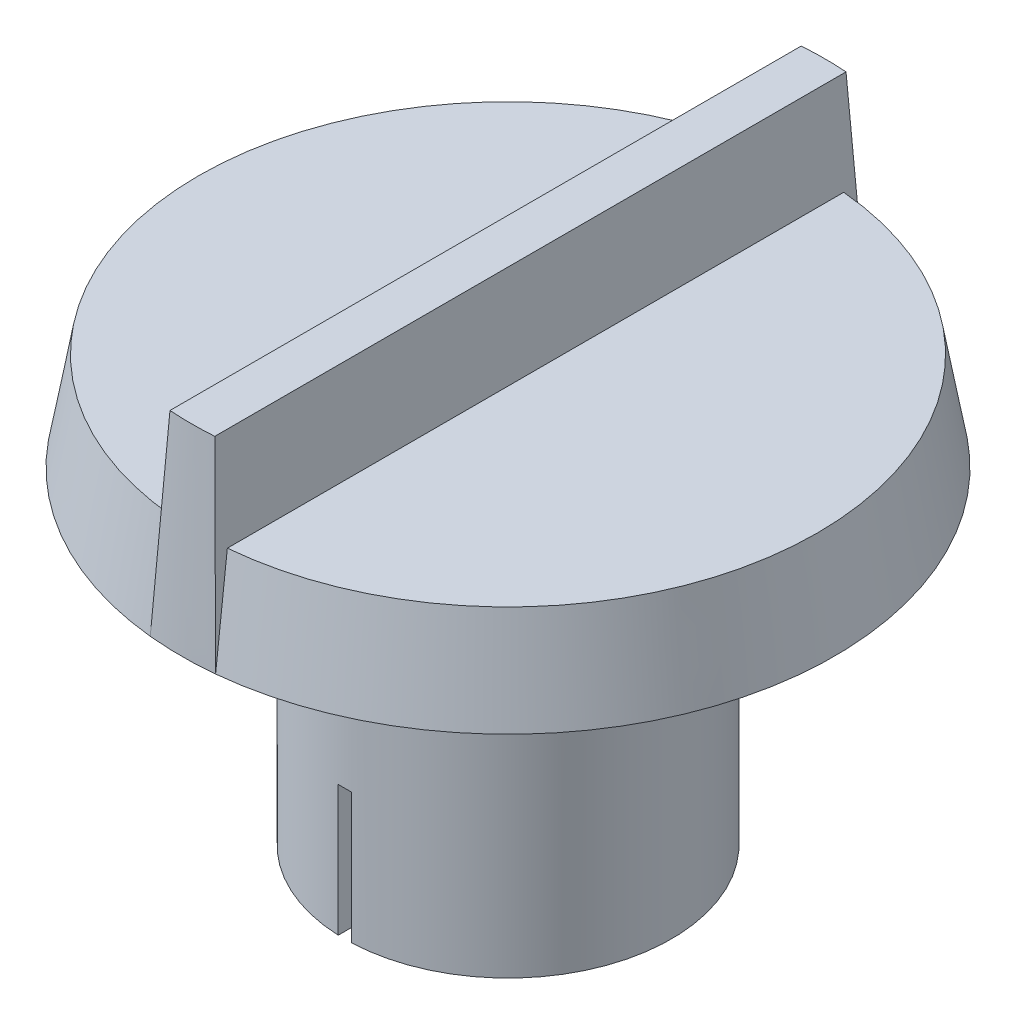
from build123d import *
from build123d.topology import SkipClean

# Parameters (mm, degrees)
ESBO_O2_R                = 10
RESSALTO_EXTRUS_O1_DEPTH = 3
RESSALTO_EXTRUS_O1_TAPER = 10
RESSALTO_EXTRUS_O2_DEPTH = 6
RESSALTO_EXTRUS_O2_DRAFT = 3
ESBO_O3_R                = 5
ESBO_O3_R_2              = 3
RESSALTO_EXTRUS_O3_DEPTH = 6
RESSALTO_EXTRUS_O4_DEPTH = 10


with BuildPart() as part:
    # Esboço2 → Ressalto-extrusão1 (new body)
    with BuildSketch(Plane(origin=(0, 0, 0), x_dir=(1, 0, 0), z_dir=(0, 1, 0))):
        Circle(ESBO_O2_R)
    extrude(amount=RESSALTO_EXTRUS_O1_DEPTH, taper=RESSALTO_EXTRUS_O1_TAPER)


with BuildPart() as ressalto_extrus_o2_tool:
    # Esboço2<3> → Ressalto-extrusão2 (with draft: the straight prism first)
    with BuildSketch(Plane(origin=(0, 0, 0), x_dir=(1, 0, 0), z_dir=(0, 1, 0))):
        with BuildLine():
            Line((-1, 9.949874371), (-1, -9.949874371))
            ThreePointArc((-1, -9.949874371), (0, -10), (1, -9.949874371))
            Line((1, -9.949874371), (1, 9.949874371))
            ThreePointArc((1, 9.949874371), (0, 10), (-1, 9.949874371))
        make_face()
    extrude(amount=RESSALTO_EXTRUS_O2_DEPTH)
    # Ressalto-extrusão2: the draft: its side faces are tilted about the plane it starts from
    ressalto_extrus_o2_sides = [ressalto_extrus_o2_tool.faces().sort_by_distance(p)[0] for p in [
        (1, 3, 0),
        (0, 3, -10),
        (-1, 3, 0),
        (0, 3, 10),
    ]]
    draft(ressalto_extrus_o2_sides, Plane(origin=(0, 0, 0), x_dir=(1, 0, 0), z_dir=(0, 1, 0)), RESSALTO_EXTRUS_O2_DRAFT)


with BuildPart() as part_1:
    add(part.part)

    # Ressalto-extrusão2: add ressalto_extrus_o2_tool
    add(ressalto_extrus_o2_tool.part)

    # Esboço3 → Ressalto-extrusão3 (add)
    with BuildSketch(Plane(origin=(0, 0, 0), x_dir=(1, 0, 0), z_dir=(0, 1, 0))):
        Circle(ESBO_O3_R)
        Circle(ESBO_O3_R_2, mode=Mode.SUBTRACT)
    extrude(amount=-RESSALTO_EXTRUS_O3_DEPTH)

    # Esboço3<3> → Ressalto-extrusão4 (add)
    with SkipClean():  # the faces are left unmerged after this step: merging them gives an invalid solid
        with BuildSketch(Plane(origin=(0, 0, 0), x_dir=(1, 0, 0), z_dir=(0, 1, 0))):
            with BuildLine():
                Line((-0.2, 2.993325909), (-0.2, 4.995998399))
                ThreePointArc((-0.2, 4.995998399), (-5, 0), (-0.2, -4.995998399))
                Line((-0.2, -4.995998399), (-0.2, -2.993325909))
                ThreePointArc((-0.2, -2.993325909), (-3, 0), (-0.2, 2.993325909))
            make_face()
            with BuildLine():
                ThreePointArc((0.2, -4.995998399), (5, 0), (0.2, 4.995998399))
                Line((0.2, 4.995998399), (0.2, 2.993325909))
                ThreePointArc((0.2, 2.993325909), (3, 0), (0.2, -2.993325909))
                Line((0.2, -2.993325909), (0.2, -4.995998399))
            make_face()
        extrude(amount=-RESSALTO_EXTRUS_O4_DEPTH)


solid = part_1.part
